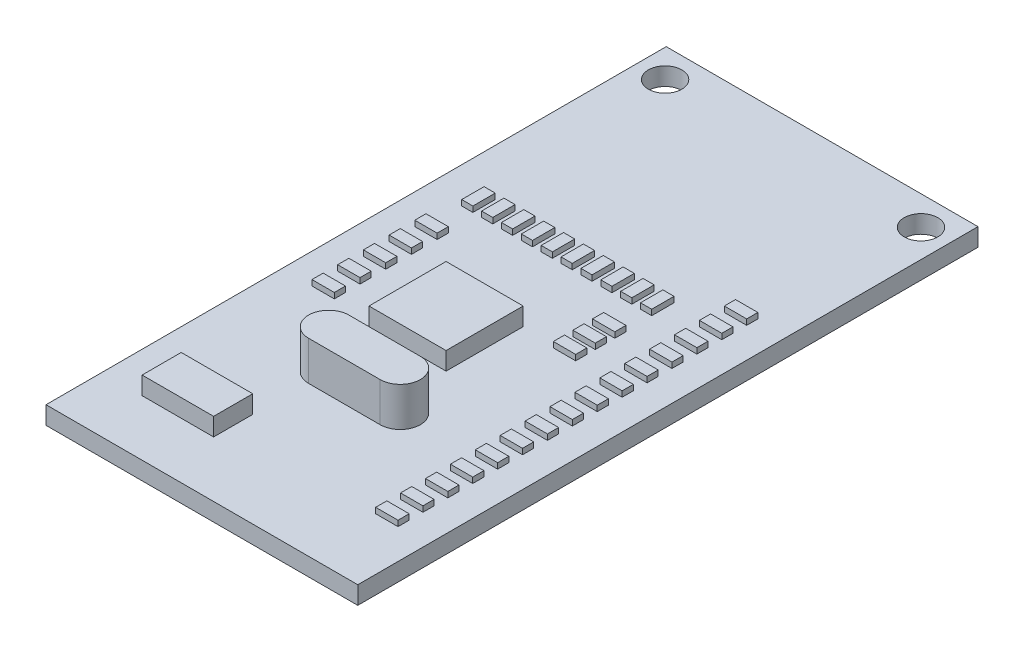
from build123d import *

# Parameters (mm, degrees)
SKETCH_1_W      = 27.9
SKETCH_1_H      = 55.5
SKETCH_1_R      = 1.5
EXTRUDE_1_DEPTH = 1.6
SKETCH_2_W      = 6.9
SKETCH_2_H      = 6.9
SKETCH_2_W_2    = 6.4
SKETCH_2_H_2    = 3.5
EXTRUDE_2_DEPTH = 1.6
EXTRUDE_3_DEPTH = 3.5
SKETCH_4_W      = 2
SKETCH_4_H      = 1
SKETCH_4_W_2    = 1
SKETCH_4_H_2    = 2
EXTRUDE_4_DEPTH = 0.5


with BuildPart() as part:
    # Эскиз1 → Бобышка-Вытянуть1 (new body)
    with BuildSketch(Plane(origin=(0, 0, 0), x_dir=(1, 0, 0), z_dir=(0, 1, 0))):
        Rectangle(SKETCH_1_W, SKETCH_1_H)
        with Locations(Location((-11.45, 25.15, 0), (0, 0, 270))):
            Circle(SKETCH_1_R, mode=Mode.SUBTRACT)
        with Locations(Location((11.45, 25.15, 0), (0, 0, 270))):
            Circle(SKETCH_1_R, mode=Mode.SUBTRACT)
    extrude(amount=EXTRUDE_1_DEPTH)

    # Эскиз2 → Бобышка-Вытянуть2 (add)
    with BuildSketch(Plane(origin=(0, 1.6, 0), x_dir=(1, 0, 0), z_dir=(0, 1, 0))):
        with Locations((-2.1, -3.8)):
            Rectangle(SKETCH_2_W, SKETCH_2_H)
        with Locations((-7.15, -21)):
            Rectangle(SKETCH_2_W_2, SKETCH_2_H_2)
    extrude(amount=EXTRUDE_2_DEPTH)

    # Эскиз3 → Бобышка-Вытянуть3 (add)
    with BuildSketch(Plane(origin=(0, 1.6, 0), x_dir=(1, 0, 0), z_dir=(0, 1, 0))):
        with BuildLine():
            Line((2.55, -14.35), (-3.85, -14.35))
            ThreePointArc((-3.85, -14.35), (-5.65, -12.55), (-3.85, -10.75))
            Line((-3.85, -10.75), (2.55, -10.75))
            ThreePointArc((2.55, -10.75), (4.35, -12.55), (2.55, -14.35))
        make_face()
    extrude(amount=EXTRUDE_3_DEPTH)

    # Эскиз4 → Бобышка-Вытянуть4 (add)
    with BuildSketch(Plane(origin=(0, 1.6, 0), x_dir=(1, 0, 0), z_dir=(0, 1, 0))):
        with Locations((10.25, -20.95)):
            Rectangle(SKETCH_4_W, SKETCH_4_H)
        with Locations((10.25, -18.721428571)):
            Rectangle(SKETCH_4_W, SKETCH_4_H)
        with Locations((10.25, -16.492857143)):
            Rectangle(SKETCH_4_W, SKETCH_4_H)
        with Locations((10.25, -14.264285714)):
            Rectangle(SKETCH_4_W, SKETCH_4_H)
        with Locations((10.25, -12.035714286)):
            Rectangle(SKETCH_4_W, SKETCH_4_H)
        with Locations((10.25, -9.807142857)):
            Rectangle(SKETCH_4_W, SKETCH_4_H)
        with Locations((10.25, -7.578571429)):
            Rectangle(SKETCH_4_W, SKETCH_4_H)
        with Locations((10.25, -5.35)):
            Rectangle(SKETCH_4_W, SKETCH_4_H)
        with Locations((10.25, -3.121428571)):
            Rectangle(SKETCH_4_W, SKETCH_4_H)
        with Locations((10.25, -0.892857143)):
            Rectangle(SKETCH_4_W, SKETCH_4_H)
        with Locations((10.25, 1.335714286)):
            Rectangle(SKETCH_4_W, SKETCH_4_H)
        with Locations((10.25, 3.564285714)):
            Rectangle(SKETCH_4_W, SKETCH_4_H)
        with Locations((10.25, 5.792857143)):
            Rectangle(SKETCH_4_W, SKETCH_4_H)
        with Locations((10.25, 8.021428571)):
            Rectangle(SKETCH_4_W, SKETCH_4_H)
        with Locations((10.25, 10.25)):
            Rectangle(SKETCH_4_W, SKETCH_4_H)
        with Locations((-10.25, 7.25)):
            Rectangle(SKETCH_4_W_2, SKETCH_4_H_2)
        with Locations((-8.472222222, 7.25)):
            Rectangle(SKETCH_4_W_2, SKETCH_4_H_2)
        with Locations((-6.694444444, 7.25)):
            Rectangle(SKETCH_4_W_2, SKETCH_4_H_2)
        with Locations((-4.916666667, 7.25)):
            Rectangle(SKETCH_4_W_2, SKETCH_4_H_2)
        with Locations((-3.138888889, 7.25)):
            Rectangle(SKETCH_4_W_2, SKETCH_4_H_2)
        with Locations((-1.361111111, 7.25)):
            Rectangle(SKETCH_4_W_2, SKETCH_4_H_2)
        with Locations((0.416666667, 7.25)):
            Rectangle(SKETCH_4_W_2, SKETCH_4_H_2)
        with Locations((2.194444444, 7.25)):
            Rectangle(SKETCH_4_W_2, SKETCH_4_H_2)
        with Locations((3.972222222, 7.25)):
            Rectangle(SKETCH_4_W_2, SKETCH_4_H_2)
        with Locations((5.75, 7.25)):
            Rectangle(SKETCH_4_W_2, SKETCH_4_H_2)
        with Locations((5.35, 3.35)):
            Rectangle(SKETCH_4_W, SKETCH_4_H)
        with Locations((5.35, 1.6)):
            Rectangle(SKETCH_4_W, SKETCH_4_H)
        with Locations((5.35, -0.15)):
            Rectangle(SKETCH_4_W, SKETCH_4_H)
        with Locations((-10.25, 0.75)):
            Rectangle(SKETCH_4_W, SKETCH_4_H)
        with Locations((-10.25, 3.05)):
            Rectangle(SKETCH_4_W, SKETCH_4_H)
        with Locations((-10.25, -1.55)):
            Rectangle(SKETCH_4_W, SKETCH_4_H)
        with Locations((-10.25, -3.85)):
            Rectangle(SKETCH_4_W, SKETCH_4_H)
        with Locations((-10.25, -6.15)):
            Rectangle(SKETCH_4_W, SKETCH_4_H)
    extrude(amount=EXTRUDE_4_DEPTH)


solid = part.part
